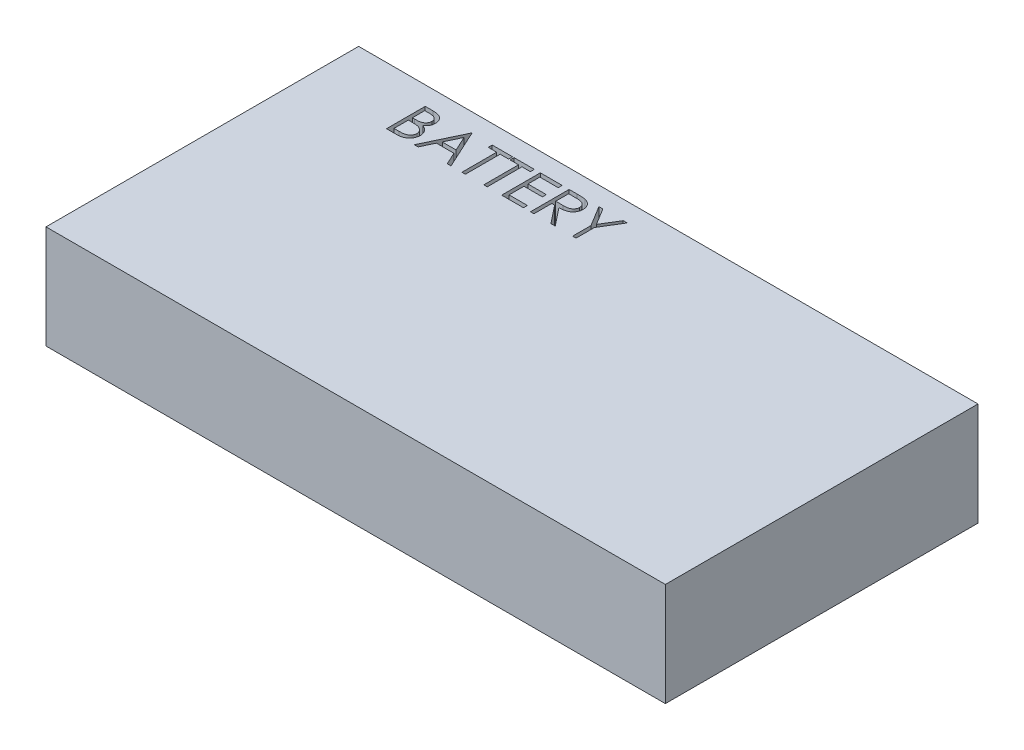
from build123d import *

# Parameters (mm, degrees)
SKETCH1_W           = 160.02
SKETCH1_H           = 80.772
BOSS_EXTRUDE1_DEPTH = 26.67
CUT_EXTRUDE1_DEPTH  = 10


with BuildPart() as part:
    # Sketch1 → Boss-Extrude1 (new body)
    with BuildSketch(Plane(origin=(0, 0, 0), x_dir=(1, 0, 0), z_dir=(0, 1, 0))):
        with Locations((80.01, 40.386)):
            Rectangle(SKETCH1_W, SKETCH1_H)
    extrude(amount=BOSS_EXTRUDE1_DEPTH)

    # Sketch2 → Cut-Extrude1 (cut)
    # profile 1 of 7: a face of its own
    with BuildSketch(Plane(origin=(0, 26.67, 0), x_dir=(1, 0, 0), z_dir=(0, 1, 0))):
        with BuildLine():
            Line((22.025384615, 75.953101149), (23.97650641, 75.953101149))
            add(Edge.make_bspline(
                [(23.97650641, 75.953101149), (24.072016348, 75.952599005), (24.257138377, 75.951625725), (24.526336783, 75.936531064), (24.778476242, 75.915949151), (25.013629877, 75.883291743), (25.231689027, 75.843886665), (25.433310847, 75.796167191), (25.617854197, 75.738948295), (25.838176301, 75.64795892), (26.089378189, 75.512749867), (26.361373597, 75.312953967), (26.593957138, 75.068575501), (26.794489473, 74.792910771), (26.953921243, 74.489665709), (27.069262092, 74.166068027), (27.142284593, 73.826291621), (27.149794405, 73.593025399), (27.153589744, 73.475136405)],
                knots=[0, 0, 0, 0, 1.001505555, 1.941167018, 2.826882275, 3.653841531, 4.429895133, 5.150066043, 5.825578002, 6.45369114, 7.647487171, 8.808567382, 9.977351308, 11.170798116, 12.373658725, 13.556498008, 14.765093433, 16, 16, 16, 16], degree=3))
            add(Edge.make_bspline(
                [(27.153589744, 73.475136405), (27.150466262, 73.364700532), (27.144328327, 73.147683626), (27.085634729, 72.830271885), (26.993747105, 72.528125546), (26.866017822, 72.242347302), (26.700012118, 71.979394121), (26.503274065, 71.73714479), (26.265911772, 71.525856056), (26.088073943, 71.407733477), (25.997740385, 71.347732559)],
                knots=[0, 0, 0, 0, 1.044552857, 2.05264487, 3.044412934, 4.028983338, 5.005914585, 5.980388656, 6.974128949, 8, 8, 8, 8], degree=3))
            add(Edge.make_bspline(
                [(25.997740385, 71.347732559), (26.111341606, 71.304118277), (26.328688885, 71.22067335), (26.627791777, 71.073143453), (26.885491334, 70.91268028), (27.103768894, 70.737446422), (27.290447908, 70.548564106), (27.453456313, 70.343263779), (27.592545953, 70.118867328), (27.711725735, 69.87771437), (27.804722181, 69.622267318), (27.874367622, 69.354922243), (27.914274619, 69.0766378), (27.919953594, 68.887251002), (27.922820513, 68.791642816)],
                knots=[0, 0, 0, 0, 1.27268992, 2.434971085, 3.483601985, 4.442670788, 5.356604649, 6.2567628, 7.179492994, 8.113709626, 9.066344395, 10.018646069, 10.999752585, 12, 12, 12, 12], degree=3))
            add(Edge.make_bspline(
                [(27.922820513, 68.791642816), (27.920029524, 68.694023181), (27.914538176, 68.501953815), (27.874023971, 68.219796288), (27.805426522, 67.950153583), (27.710937533, 67.691281632), (27.587616634, 67.443681248), (27.437536736, 67.207071923), (27.258589411, 66.983830978), (27.058409785, 66.771477769), (26.831946513, 66.580541234), (26.587615784, 66.410496358), (26.322340585, 66.270650466), (26.040477744, 66.153176119), (25.738865413, 66.063441266), (25.418857963, 66.000662483), (25.080731386, 65.958362378), (24.848703526, 65.954884649), (24.729711538, 65.953101149)],
                knots=[0, 0, 0, 0, 0.978564426, 1.925352924, 2.850884081, 3.763762016, 4.682927383, 5.618979971, 6.567305752, 7.547517671, 8.540179244, 9.531824382, 10.526200242, 11.540722885, 12.589160233, 13.674978461, 14.80764778, 16, 16, 16, 16], degree=3))
            Line((24.729711538, 65.953101149), (22.025384615, 65.953101149))
            Line((22.025384615, 65.953101149), (22.025384615, 75.953101149))
        make_face()
        with BuildLine():
            Line((22.922820513, 74.927460123), (22.922820513, 71.722331918))
            Line((22.922820513, 71.722331918), (23.525785256, 71.722331918))
            add(Edge.make_bspline(
                [(23.525785256, 71.722331918), (23.613924672, 71.723474555), (23.784227984, 71.725682363), (24.03085626, 71.732006698), (24.259784883, 71.749715393), (24.470618692, 71.767418999), (24.663025675, 71.796203535), (24.836579565, 71.830466744), (24.994004127, 71.866703615), (25.175545686, 71.928330721), (25.381468396, 72.019409793), (25.600991551, 72.160757896), (25.794518607, 72.329113191), (25.957939143, 72.523373081), (26.091686202, 72.73727647), (26.184582531, 72.967410414), (26.247574771, 73.208039362), (26.253264861, 73.37323437), (26.256153846, 73.457107559)],
                knots=[0, 0, 0, 0, 1.156816544, 2.235205308, 3.236616184, 4.169592532, 5.011045266, 5.787822928, 6.49130361, 7.128639758, 8.301311294, 9.436451833, 10.541879658, 11.654887649, 12.756523258, 13.837046038, 14.901820046, 16, 16, 16, 16], degree=3))
            add(Edge.make_bspline(
                [(26.256153846, 73.457107559), (26.254650474, 73.512609764), (26.251701446, 73.621483398), (26.227549153, 73.780195839), (26.18649894, 73.929463703), (26.133772388, 74.07133259), (26.06009042, 74.201366447), (25.973337668, 74.324061292), (25.86852141, 74.435238774), (25.749214802, 74.539151626), (25.612047309, 74.631278848), (25.45710076, 74.711966743), (25.282278826, 74.776940391), (25.090527812, 74.833843683), (24.878896133, 74.873810237), (24.649825981, 74.90710563), (24.401441069, 74.924056322), (24.229597919, 74.926300216), (24.140769231, 74.927460123)],
                knots=[0, 0, 0, 0, 0.91205012, 1.789085906, 2.630437955, 3.453916878, 4.269457761, 5.079663411, 5.91843418, 6.774407191, 7.675494373, 8.627863946, 9.638891023, 10.736472738, 11.911756761, 13.175263542, 14.539845004, 16, 16, 16, 16], degree=3))
            Line((24.140769231, 74.927460123), (22.922820513, 74.927460123))
        make_face(mode=Mode.SUBTRACT)
        with BuildLine():
            Line((22.922820513, 70.696690893), (22.922820513, 66.978742175))
            Line((22.922820513, 66.978742175), (24.200865385, 66.978742175))
            add(Edge.make_bspline(
                [(24.200865385, 66.978742175), (24.29234803, 66.979838596), (24.468668769, 66.981951803), (24.723243712, 66.98885053), (24.959195437, 67.004542747), (25.175447254, 67.029245174), (25.374334261, 67.056040743), (25.553470555, 67.092072974), (25.714308251, 67.133355719), (25.900806273, 67.197167639), (26.110816297, 67.296300413), (26.337133029, 67.445769632), (26.538350796, 67.623836225), (26.709222965, 67.829924552), (26.849260075, 68.054014057), (26.951132804, 68.2915722), (27.013963823, 68.538673707), (27.021570021, 68.707150028), (27.025384615, 68.791642816)],
                knots=[0, 0, 0, 0, 1.160039823, 2.235823828, 3.228722157, 4.157150951, 4.99529583, 5.772374946, 6.472645482, 7.099169577, 8.269452708, 9.405989375, 10.527446681, 11.663510218, 12.788923519, 13.866172445, 14.929861265, 16, 16, 16, 16], degree=3))
            add(Edge.make_bspline(
                [(27.025384615, 68.791642816), (27.024595746, 68.844480931), (27.023030731, 68.949304879), (26.999428974, 69.103350077), (26.965103632, 69.252566858), (26.920728107, 69.397360402), (26.856101058, 69.535112906), (26.780653786, 69.66854879), (26.692192639, 69.797844446), (26.554352165, 69.961308027), (26.353860781, 70.14964235), (26.068984279, 70.334035213), (25.745063428, 70.482743234), (25.510127734, 70.545884595), (25.388766026, 70.57850179)],
                knots=[0, 0, 0, 0, 0.723448775, 1.435228256, 2.130040452, 2.821711965, 3.505591119, 4.210454504, 4.921174351, 5.648778258, 7.137944449, 8.670945889, 10.280296675, 12, 12, 12, 12], degree=3))
            add(Edge.make_bspline(
                [(25.388766026, 70.57850179), (25.340111466, 70.588373458), (25.234618345, 70.609777272), (25.062596687, 70.63237071), (24.86620849, 70.652499453), (24.645000269, 70.667388475), (24.398692152, 70.682778599), (24.126758098, 70.688763802), (23.830308628, 70.695904545), (23.624616135, 70.696422072), (23.517772436, 70.696690893)],
                knots=[0, 0, 0, 0, 0.634451884, 1.375622551, 2.216452059, 3.157844607, 4.20941857, 5.370758133, 6.634282058, 8, 8, 8, 8], degree=3))
            Line((23.517772436, 70.696690893), (22.922820513, 70.696690893))
        make_face(mode=Mode.SUBTRACT)
    # profile 2 of 7: a face of its own
    with BuildSketch(Plane(origin=(0, 26.67, 0), x_dir=(1, 0, 0), z_dir=(0, 1, 0))):
        Polygon((34.076666667, 75.953101149), (38.692051282, 65.953101149), (37.716490385, 65.953101149), (36.238125, 69.158229354), (31.704871795, 69.158229354), (30.184439103, 65.953101149), (29.204871795, 65.953101149), (33.948461538, 75.953101149), align=None)
        Polygon((34.002548077, 74.003982559), (32.191650641, 70.18387038), (35.76536859, 70.18387038), align=None, mode=Mode.SUBTRACT)
    # profile 3 of 7: a face of its own
    with BuildSketch(Plane(origin=(0, 26.67, 0), x_dir=(1, 0, 0), z_dir=(0, 1, 0))):
        Polygon((39.333076923, 74.927460123), (39.333076923, 75.953101149), (44.589487179, 75.953101149), (44.589487179, 74.927460123), (42.41, 74.927460123), (42.41, 65.953101149), (41.512564103, 65.953101149), (41.512564103, 74.927460123), align=None)
    # profile 4 of 7: a face of its own
    with BuildSketch(Plane(origin=(0, 26.67, 0), x_dir=(1, 0, 0), z_dir=(0, 1, 0))):
        Polygon((44.974102564, 74.927460123), (44.974102564, 75.953101149), (50.230512821, 75.953101149), (50.230512821, 74.927460123), (48.051025641, 74.927460123), (48.051025641, 65.953101149), (47.153589744, 65.953101149), (47.153589744, 74.927460123), align=None)
    # profile 5 of 7: a face of its own
    with BuildSketch(Plane(origin=(0, 26.67, 0), x_dir=(1, 0, 0), z_dir=(0, 1, 0))):
        Polygon((51.768974359, 75.953101149), (57.41, 75.953101149), (57.41, 74.927460123), (52.666410256, 74.927460123), (52.666410256, 71.850537046), (57.41, 71.850537046), (57.41, 70.824896021), (52.666410256, 70.824896021), (52.666410256, 66.978742175), (57.41, 66.978742175), (57.41, 65.953101149), (51.768974359, 65.953101149), align=None)
    # profile 6 of 7: a face of its own
    with BuildSketch(Plane(origin=(0, 26.67, 0), x_dir=(1, 0, 0), z_dir=(0, 1, 0))):
        with BuildLine():
            Line((59.204871795, 75.953101149), (61.206073718, 75.953101149))
            add(Edge.make_bspline(
                [(61.206073718, 75.953101149), (61.339619799, 75.952656618), (61.596043069, 75.951803068), (61.96339527, 75.947043745), (62.297186976, 75.933402729), (62.59724366, 75.921663919), (62.863559817, 75.900258373), (63.096952076, 75.879799381), (63.296345497, 75.853017493), (63.41704793, 75.828144856), (63.471698718, 75.8168832)],
                knots=[0, 0, 0, 0, 1.410062039, 2.707475311, 3.878576406, 4.937260626, 5.877586885, 6.699081471, 7.410979367, 8, 8, 8, 8], degree=3))
            add(Edge.make_bspline(
                [(63.471698718, 75.8168832), (63.544860501, 75.798806728), (63.689623328, 75.763039403), (63.898052088, 75.687440544), (64.096664443, 75.599955902), (64.284635369, 75.497202415), (64.461023344, 75.37841733), (64.627647089, 75.245651266), (64.785262699, 75.099630678), (64.927495928, 74.936673988), (65.061607504, 74.765712532), (65.174717866, 74.580844655), (65.272222093, 74.387526005), (65.349852142, 74.183790526), (65.412360638, 73.971614035), (65.456435607, 73.749074616), (65.482867572, 73.517186116), (65.485558588, 73.359020662), (65.486923077, 73.278822303)],
                knots=[0, 0, 0, 0, 1.027469482, 2.033020251, 3.019912614, 3.986113645, 4.951240523, 5.91722682, 6.890402269, 7.87763091, 8.8651537, 9.85103654, 10.82876324, 11.815024772, 12.821070561, 13.842952187, 14.906261191, 16, 16, 16, 16], degree=3))
            add(Edge.make_bspline(
                [(65.486923077, 73.278822303), (65.482725939, 73.145579147), (65.474536237, 72.885587239), (65.398178798, 72.508270434), (65.273103027, 72.156300964), (65.100750773, 71.830121999), (64.881266557, 71.536091583), (64.617481439, 71.27783314), (64.309248264, 71.061719104), (64.022307361, 70.911853947), (63.768838219, 70.815874208), (63.560171611, 70.748341755), (63.332551675, 70.696164711), (63.088159291, 70.649421477), (62.825977418, 70.614130922), (62.546634448, 70.588283509), (62.249931158, 70.572129084), (62.046105245, 70.569723356), (61.94125, 70.568485764)],
                knots=[0, 0, 0, 0, 1.260483769, 2.459530307, 3.627416485, 4.787058657, 5.939039949, 7.08810263, 8.267026773, 9.491475466, 10.141966685, 10.831826277, 11.566392101, 12.351337768, 13.187381173, 14.07005841, 15.007169909, 16, 16, 16, 16], degree=3))
            Line((61.94125, 70.568485764), (65.615128205, 65.953101149))
            Line((65.615128205, 65.953101149), (64.505352564, 65.953101149))
            Line((64.505352564, 65.953101149), (60.831474359, 70.568485764))
            Line((60.831474359, 70.568485764), (60.102307692, 70.568485764))
            Line((60.102307692, 70.568485764), (60.102307692, 65.953101149))
            Line((60.102307692, 65.953101149), (59.204871795, 65.953101149))
            Line((59.204871795, 65.953101149), (59.204871795, 75.953101149))
        make_face()
        with BuildLine():
            Line((60.102307692, 74.927460123), (60.102307692, 71.59412679))
            Line((60.102307692, 71.59412679), (61.933237179, 71.580104354))
            add(Edge.make_bspline(
                [(61.933237179, 71.580104354), (62.018723005, 71.580066535), (62.184418882, 71.579993231), (62.424135068, 71.59140402), (62.647335387, 71.60438493), (62.853166107, 71.624240203), (63.04171918, 71.649828979), (63.21290036, 71.681837505), (63.36698908, 71.719129113), (63.54669919, 71.776848044), (63.747374994, 71.86829381), (63.965464879, 72.001338092), (64.151185844, 72.168678433), (64.308094022, 72.360031164), (64.434178112, 72.570420447), (64.523069696, 72.797324359), (64.579476674, 73.035014639), (64.586129661, 73.198380661), (64.589487179, 73.280825508)],
                knots=[0, 0, 0, 0, 1.146690395, 2.22261258, 3.21895312, 4.145990853, 4.996080663, 5.770904154, 6.481378293, 7.121626537, 8.300444488, 9.431385265, 10.535395872, 11.636531494, 12.74115979, 13.810798291, 14.895190096, 16, 16, 16, 16], degree=3))
            add(Edge.make_bspline(
                [(64.589487179, 73.280825508), (64.586052548, 73.36124429), (64.579246361, 73.520604972), (64.523678451, 73.753907573), (64.42970879, 73.974098859), (64.303073824, 74.180283102), (64.148790525, 74.367442347), (63.967882488, 74.52757707), (63.765296216, 74.659718398), (63.575949935, 74.744159485), (63.406709328, 74.795930494), (63.259767443, 74.832362391), (63.093734649, 74.861632302), (62.907804767, 74.885083904), (62.702771536, 74.905240888), (62.477598248, 74.918817398), (62.233778875, 74.92685701), (62.064787643, 74.927254407), (61.977307692, 74.927460123)],
                knots=[0, 0, 0, 0, 1.101028733, 2.181837193, 3.264309656, 4.369019818, 5.486613113, 6.575447106, 7.666700264, 8.788928104, 9.402425223, 10.0903467, 10.862060571, 11.710948788, 12.657782767, 13.684531032, 14.801375019, 16, 16, 16, 16], degree=3))
            Line((61.977307692, 74.927460123), (60.102307692, 74.927460123))
        make_face(mode=Mode.SUBTRACT)
    # profile 7 of 7: a face of its own
    with BuildSketch(Plane(origin=(0, 26.67, 0), x_dir=(1, 0, 0), z_dir=(0, 1, 0))):
        Polygon((66.897179487, 75.953101149), (67.924823718, 75.953101149), (70.553028846, 71.656226149), (73.177227564, 75.953101149), (74.204871795, 75.953101149), (70.99974359, 70.706706918), (70.99974359, 65.953101149), (70.102307692, 65.953101149), (70.102307692, 70.706706918), align=None)
    extrude(amount=-CUT_EXTRUDE1_DEPTH, mode=Mode.SUBTRACT)


solid = part.part
